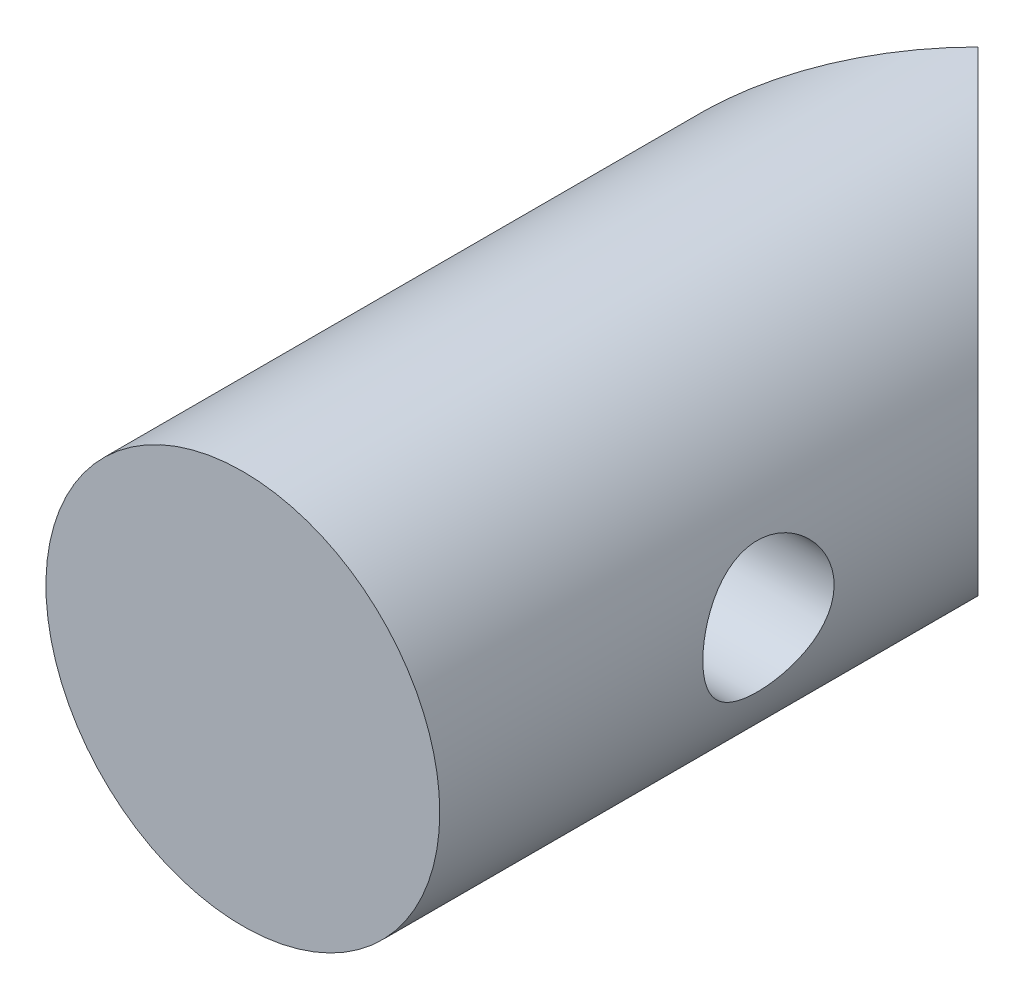
from build123d import *

# Parameters (mm, degrees)
SKETCH1_R                    = 4.7625
EXTRUDE1_DEPTH               = 17.78
EXTRUDE2_DEPTH               = 20.01292225
EXTRUDE2_DEPTH_BACK          = 20.01292225
F_1_8_0_125_DIAMETER_HOLE4_D = 3.175


with BuildPart() as part:
    # Sketch1 → Extrude1 (new body)
    with BuildSketch(Plane.XY):
        Circle(SKETCH1_R)
    extrude(amount=EXTRUDE1_DEPTH)

    # Sketch2 → Extrude2 (cut, two sides: drawn at the far end of the back side and taken through both)
    with BuildSketch(Plane(origin=(0, 0, 0), x_dir=(1, 0, 0), z_dir=(0, 1, 0)).offset(-EXTRUDE2_DEPTH_BACK)):
        Polygon((0, 0), (4.7625, -4.7625), (4.7625, 1.90519665), (-4.7625, 1.90519665), (-4.7625, -4.7625), align=None)
    extrude(amount=EXTRUDE2_DEPTH + EXTRUDE2_DEPTH_BACK, mode=Mode.SUBTRACT)

    # 1/8 (0.125) Diameter Hole4 (through all)
    with Locations(Plane(origin=(-4.7625, 0, 17.78), x_dir=(0, 0, 1), z_dir=(-1, 0, 0))):
        with Locations((-7.9502, 0)):
            Hole(F_1_8_0_125_DIAMETER_HOLE4_D / 2)


solid = part.part
